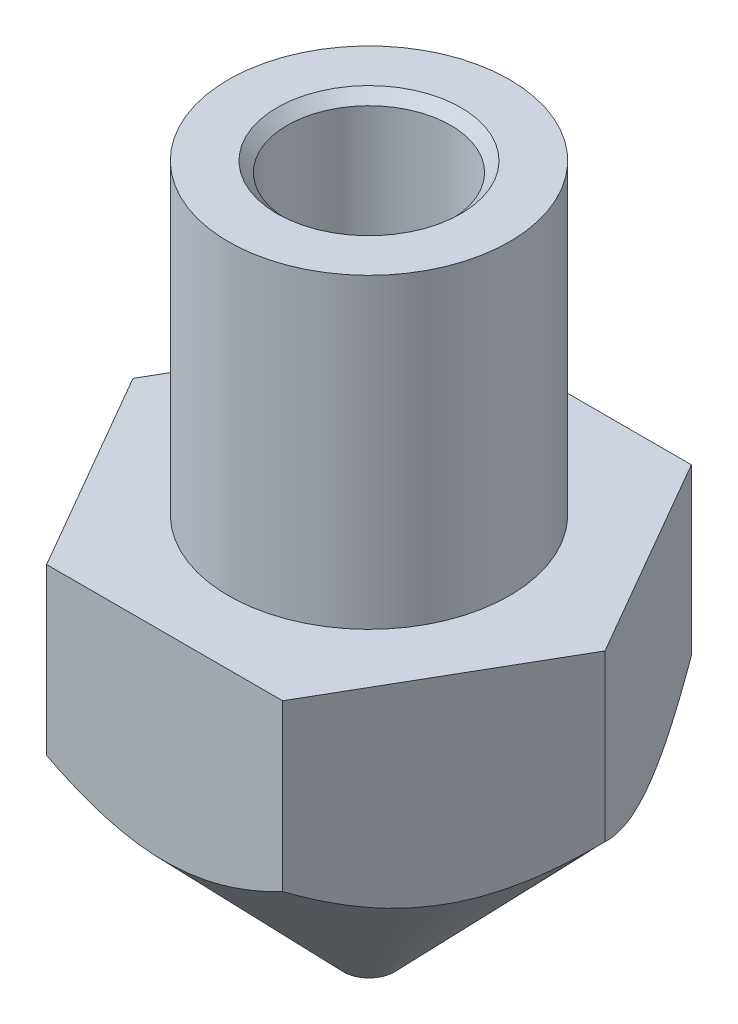
from build123d import *

# Parameters (mm, degrees)
CROQUIS2_R            = 7.742665811
CORTAR_EXTRUIR1_DEPTH = 14.272066445
CHAFL_N1_SIZE         = 0.2


with BuildPart() as part:
    # Croquis1 → Revolución1 (revolve)
    with BuildSketch(Plane.XY, mode=Mode.PRIVATE) as revoluci_n1_sk:
        Polygon((0.2, 0), (0.5, 0), (7.742665811, 7.5), (2.75, 7.5), (2.75, 13.5), (1.6, 13.5), (1.6, 2.424871131), align=None)
    revolve(revoluci_n1_sk.sketch.rotate(Axis((0, 0, 0), (0, 1, 0)), 270), axis=Axis((0, 0, 0), (0, 1, 0)))

    # Croquis2 → Cortar-Extruir1 (cut, through all)
    with BuildSketch(Plane(origin=(0, 7.5, 0), x_dir=(1, 0, 0), z_dir=(0, 1, 0))):
        Circle(CROQUIS2_R)
        Polygon((2.309401077, 4), (-2.309401077, 4), (-4.618802154, 0), (-2.309401077, -4), (2.309401077, -4), (4.618802154, 0), align=None, mode=Mode.SUBTRACT)
    extrude(amount=-CORTAR_EXTRUIR1_DEPTH, mode=Mode.SUBTRACT)

    # Chaflán1
    chafl_n1_edges = [part.edges().sort_by_distance(p)[0] for p in [
        (0, 13.5, -1.6),
    ]]
    chamfer(chafl_n1_edges, length=CHAFL_N1_SIZE)


solid = part.part
